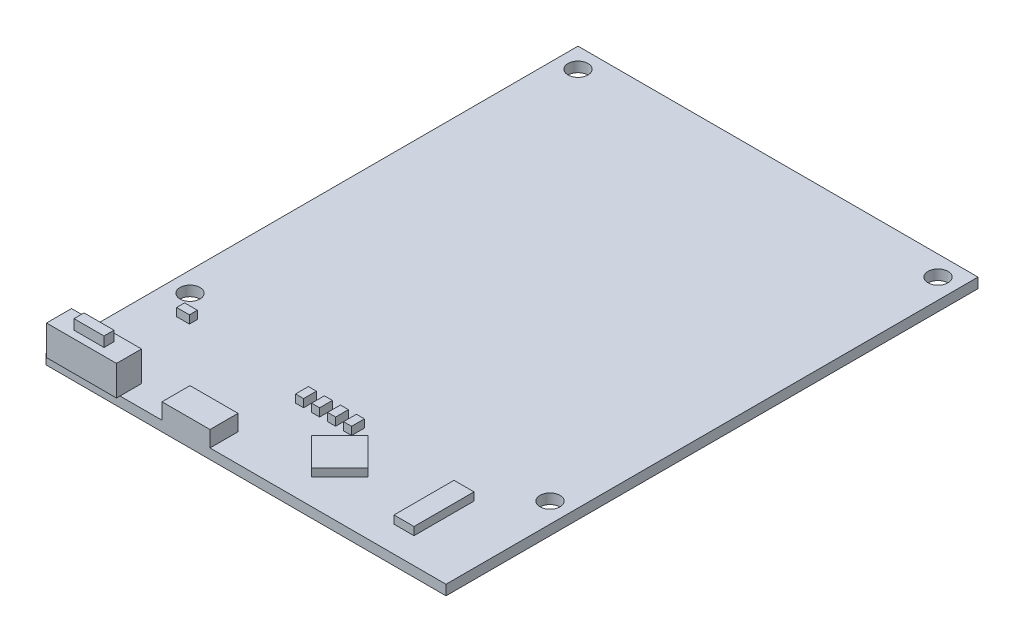
from build123d import *

# Parameters (mm, degrees)
SKETCH1_W                = 63.5
SKETCH1_H                = 84.455
SKETCH1_R                = 1.5875
BOSS_EXTRUDE1_DEPTH      = 1.6
SKETCH2_W                = 1.27
SKETCH2_H                = 2.032
SKETCH2_W_2              = 3.175
SKETCH2_H_2              = 9.525
SKETCH2_W_3              = 2.032
SKETCH2_H_3              = 1.27
BOSS_EXTRUDE2_DEPTH      = 1.27
SKETCH3_W                = 7.62
SKETCH3_H                = 4.445
BOSS_EXTRUDE3_DEPTH      = 2.54
BOSS_EXTRUDE4_DEPTH      = 1.984375
BOSS_EXTRUDE4_DEPTH_BACK = 1.984375
BOSS_EXTRUDE4_START      = -1.42875
CUT_EXTRUDE1_REACH       = 94.284
CUT_EXTRUDE1_START       = -1.190625
SKETCH5_W                = 4.7625
SKETCH5_H                = 1.5875
CUT_EXTRUDE2_REACH       = 95.872
CUT_EXTRUDE2_START       = -2.778125
SKETCH5_2_W              = 4.7625
SKETCH5_2_H              = 1.5875


with BuildPart() as part:
    # Sketch1 → Boss-Extrude1 (new body)
    with BuildSketch(Plane(origin=(0, 0, 0), x_dir=(1, 0, 0), z_dir=(0, 1, 0))):
        Rectangle(SKETCH1_W, SKETCH1_H)
        with Locations((-28.575, 39.0525)):
            Circle(SKETCH1_R, mode=Mode.SUBTRACT)
        with Locations((28.575, 39.0525)):
            Circle(SKETCH1_R, mode=Mode.SUBTRACT)
        with Locations((-28.575, -22.5425)):
            Circle(SKETCH1_R, mode=Mode.SUBTRACT)
        with Locations((28.575, -22.5425)):
            Circle(SKETCH1_R, mode=Mode.SUBTRACT)
    extrude(amount=BOSS_EXTRUDE1_DEPTH)

    # Sketch2 → Boss-Extrude2 (add)
    with BuildSketch(Plane(origin=(0, 1.6, 0), x_dir=(1, 0, 0), z_dir=(0, 1, 0))):
        Polygon((6.35, -29.228371939), (10.840128061, -33.7185), (6.35, -38.208628061), (1.859871939, -33.7185), align=None)
        with Locations((-1.905, -28.2575)):
            Rectangle(SKETCH2_W, SKETCH2_H)
        with Locations((-4.445, -28.2575)):
            Rectangle(SKETCH2_W, SKETCH2_H)
        with Locations((0.635, -28.2575)):
            Rectangle(SKETCH2_W, SKETCH2_H)
        with Locations((3.175, -28.2575)):
            Rectangle(SKETCH2_W, SKETCH2_H)
        with Locations((20.955, -33.3375)):
            Rectangle(SKETCH2_W_2, SKETCH2_H_2)
        with Locations((-25.4, -26.19375)):
            Rectangle(SKETCH2_W_3, SKETCH2_H_3)
    extrude(amount=BOSS_EXTRUDE2_DEPTH)

    # Sketch3 → Boss-Extrude3 (add)
    with BuildSketch(Plane(origin=(0, 1.6, 0), x_dir=(1, 0, 0), z_dir=(0, 1, 0))):
        with Locations((-9.525, -40.005)):
            Rectangle(SKETCH3_W, SKETCH3_H)
    extrude(amount=BOSS_EXTRUDE3_DEPTH)

    # Sketch4 → Boss-Extrude4 (add, two sides: drawn at the far end of the back side and taken through both)
    with BuildSketch(Plane.XY.offset(42.2275).offset(BOSS_EXTRUDE4_START - BOSS_EXTRUDE4_DEPTH_BACK)):
        Polygon((-27.94, 6.3625), (-31.115, 6.3625), (-31.115, 1.6), (-20.0025, 1.6), (-20.0025, 6.3625), (-23.1775, 6.3625), (-23.1775, 7.95), (-27.94, 7.95), align=None)
    extrude(amount=BOSS_EXTRUDE4_DEPTH + BOSS_EXTRUDE4_DEPTH_BACK)

    # Sketch5 → Cut-Extrude1 (cut, up to next)
    with BuildSketch(Plane.XY.offset(42.783125).offset(CUT_EXTRUDE1_START), mode=Mode.PRIVATE) as cut_extrude1_sk1:
        with Locations((-25.55875, 7.15625)):
            Rectangle(SKETCH5_W, SKETCH5_H)
    cut_extrude1_tool1 = extrude(cut_extrude1_sk1.sketch, amount=CUT_EXTRUDE1_REACH, mode=Mode.PRIVATE) & part.part
    add(cut_extrude1_tool1.solids().sort_by_distance((-25.55875, 7.15625, 41.5925))[0], mode=Mode.SUBTRACT)

    # Sketch5<2> → Cut-Extrude2 (cut, up to next)
    with BuildSketch(Plane.XY.offset(42.783125).offset(CUT_EXTRUDE2_START), mode=Mode.PRIVATE) as cut_extrude2_sk1:
        with Locations((-25.55875, 7.15625)):
            Rectangle(SKETCH5_2_W, SKETCH5_2_H)
    cut_extrude2_tool1 = extrude(cut_extrude2_sk1.sketch, amount=-CUT_EXTRUDE2_REACH, mode=Mode.PRIVATE) & part.part
    add(cut_extrude2_tool1.solids().sort_by_distance((-25.55875, 7.15625, 40.005))[0], mode=Mode.SUBTRACT)


solid = part.part
